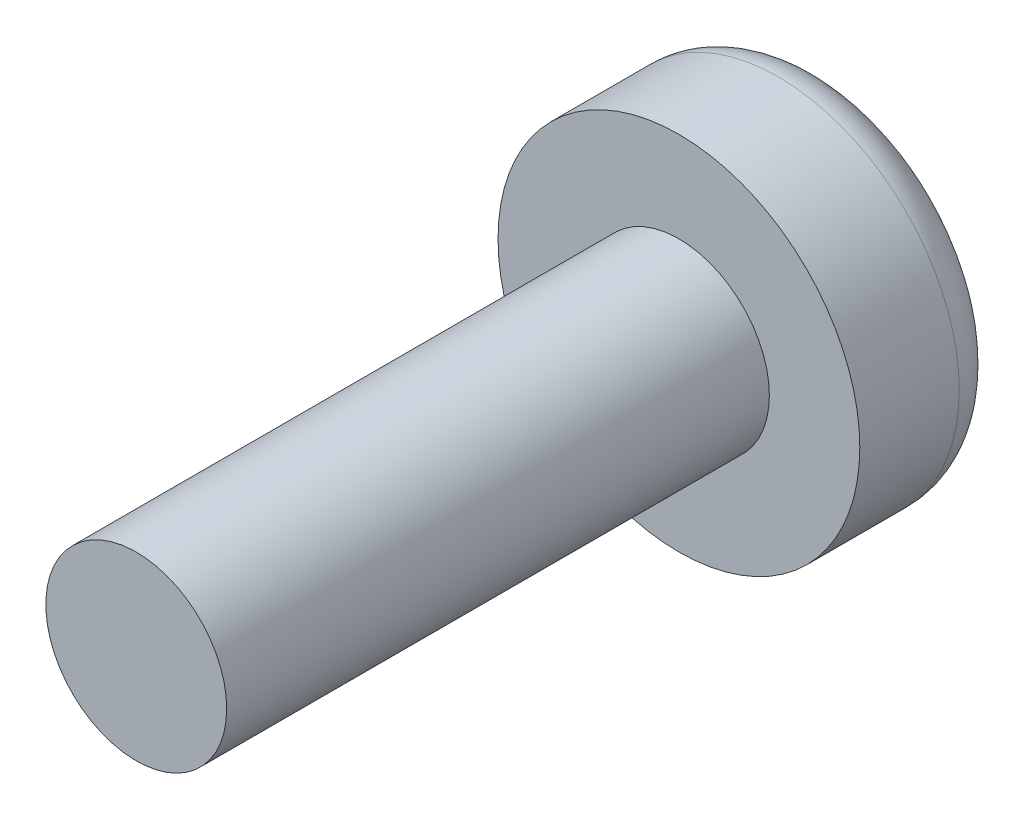
from build123d import *

# Parameters (mm, degrees)
ESQUISSE1_R             = 2.4
ESQUISSE1_R_2           = 2.16514488
BOSS_EXTRU_1_DEPTH      = 1.92
ENL_V_MAT_EXTRU_1_DEPTH = 0.72
CONG_6_R                = 0.36
ESQUISSE3_R             = 1.2
BOSS_EXTRU_2_DEPTH      = 7.2
CONG_7_R                = 0.6


with BuildPart() as part:
    # Esquisse1 → Boss.-Extru.1 (new body)
    # profile 1 of 3: a face of its own
    with BuildSketch(Plane.XY):
        Circle(ESQUISSE1_R)
        Circle(ESQUISSE1_R_2, mode=Mode.SUBTRACT)
    # profile 2 of 3: a face of its own
    with BuildSketch(Plane.XY):
        Circle(ESQUISSE1_R_2)
        Polygon((-0.258, -1.318102798), (-0.258, -0.258), (-1.224, -0.258), (-1.224, 0.258), (-0.258, 0.258), (-0.258, 1.318102798), (0.258, 1.318102798), (0.258, 0.258), (1.224, 0.258), (1.224, -0.258), (0.258, -0.258), (0.258, -1.318102798), align=None, mode=Mode.SUBTRACT)
    # profile 3 of 3: a face of its own
    with BuildSketch(Plane.XY):
        Polygon((-0.258, -0.258), (-1.224, -0.258), (-1.224, 0.258), (-0.258, 0.258), (-0.258, 1.318102798), (0.258, 1.318102798), (0.258, 0.258), (1.224, 0.258), (1.224, -0.258), (0.258, -0.258), (0.258, -1.318102798), (-0.258, -1.318102798), align=None)
    extrude(amount=BOSS_EXTRU_1_DEPTH)

    # Esquisse2 → Enlèv. mat.-Extru.1 (cut)
    with BuildSketch(Plane(origin=(0, 0, 0), x_dir=(-1, 0, 0), z_dir=(0, 0, -1))):
        Polygon((0, -1.224), (0, 0), (-1.224, 0), (-1.224, -0.258), (-0.258, -0.258), (-0.258, -1.224), align=None)
        Polygon((0, 0), (0, 1.224), (-0.258, 1.224), (-0.258, 0.258), (-1.224, 0.258), (-1.224, 0), align=None)
        Polygon((0.258, 1.224), (0, 1.224), (0, 0), (1.224, 0), (1.224, 0.258), (0.258, 0.258), align=None)
        Polygon((1.224, 0), (0, 0), (0, -1.224), (0.258, -1.224), (0.258, -0.258), (1.224, -0.258), align=None)
    extrude(amount=-ENL_V_MAT_EXTRU_1_DEPTH, mode=Mode.SUBTRACT)

    # Congé6
    cong_6_edges = [part.edges().sort_by_distance(p)[0] for p in [
        (0, -1.224, 0.72),
        (1.224, 0, 0.72),
        (-1.224, 0, 0.72),
        (0, 1.224, 0.72),
    ]]
    fillet(cong_6_edges, radius=CONG_6_R)

    # Esquisse3 → Boss.-Extru.2 (add)
    with BuildSketch(Plane.XY.offset(1.92)):
        Circle(ESQUISSE3_R)
    extrude(amount=BOSS_EXTRU_2_DEPTH)

    # Congé7
    cong_7_edges = [part.edges().sort_by_distance(p)[0] for p in [
        (-2.4, 0, 0),
    ]]
    fillet(cong_7_edges, radius=CONG_7_R)


solid = part.part
